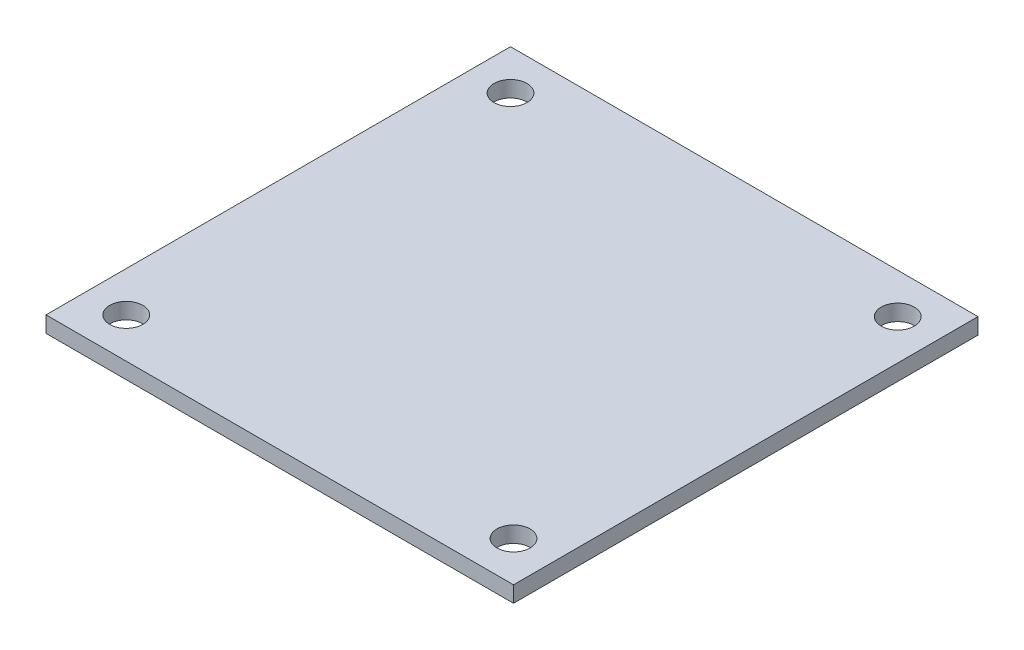
from build123d import *

# Parameters (mm, degrees)
SKETCH1_W               = 46.6
SKETCH1_H               = 46.3
BOSS_EXTRUDE1_DEPTH     = 1.6
SKETCH2_R               = 1.65
CUT_EXTRUDE1_DEPTH      = 46.709051233
MIRROR3_COPY_1_SKETCH_R = 1.65
MIRROR3_COPY_1_DEPTH    = 46.709051233


with BuildPart() as part:
    # Sketch1 → Boss-Extrude1 (new body)
    with BuildSketch(Plane(origin=(0, 0, 0), x_dir=(1, 0, 0), z_dir=(0, 1, 0))):
        with Locations((15.315469417, 1.254976672)):
            Rectangle(SKETCH1_W, SKETCH1_H)
    extrude(amount=BOSS_EXTRUDE1_DEPTH)

    # Sketch2 → Cut-Extrude1 (cut, through all)
    with BuildSketch(Plane.XZ):
        with Locations(Location((-3.984530583, -20.404976672, 0), (0, 0, 270))):
            Circle(SKETCH2_R)
    cut_extrude1 = extrude(amount=-CUT_EXTRUDE1_DEPTH, mode=Mode.SUBTRACT)

    # Mirror1: Cut-Extrude1 across plane
    add(cut_extrude1.mirror(Plane(origin=(15.315469417, 0, 0), x_dir=(0, 0, 1), z_dir=(1, 0, 0))), mode=Mode.SUBTRACT)

    # Mirror3: Cut-Extrude1 across plane
    add(cut_extrude1.mirror(Plane(origin=(0, 0, -1.254976672), x_dir=(1, 0, 0), z_dir=(0, 0, -1))), mode=Mode.SUBTRACT)

    # Mirror3 copy 1 sketch → Mirror3 copy 1 (cut, through all)
    with BuildSketch(Plane(origin=(30.630938834, 0, -2.509953343), x_dir=(-1, 0, 0), z_dir=(0, -1, 0))):
        with Locations(Location((-3.984530583, -20.404976672, 0), (0, 0, 270))):
            Circle(MIRROR3_COPY_1_SKETCH_R)
    extrude(amount=-MIRROR3_COPY_1_DEPTH, mode=Mode.SUBTRACT)


solid = part.part
